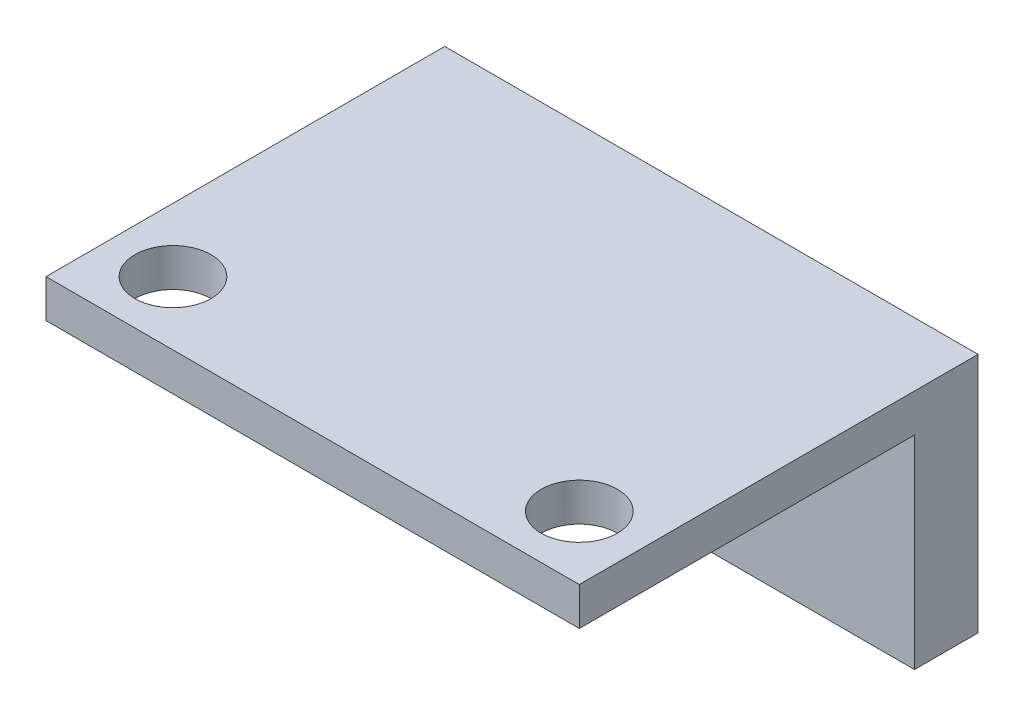
from build123d import *

# Parameters (mm, degrees)
SKETCH1_W           = 21
SKETCH1_H           = 15.7
BOSS_EXTRUDE1_DEPTH = 1.5
SKETCH2_R           = 1.5
CUT_EXTRUDE1_DEPTH  = 1.5
SKETCH3_W           = 21
SKETCH3_H           = 2.5
BOSS_EXTRUDE2_DEPTH = 8


with BuildPart() as part:
    # Sketch1 → Boss-Extrude1 (new body)
    with BuildSketch(Plane(origin=(0, 0, 0), x_dir=(1, 0, 0), z_dir=(0, 1, 0))):
        with Locations((10.5, 7.85)):
            Rectangle(SKETCH1_W, SKETCH1_H)
    extrude(amount=BOSS_EXTRUDE1_DEPTH)

    # Sketch2 → Cut-Extrude1 (cut)
    with BuildSketch(Plane(origin=(0, 1.5, 0), x_dir=(1, 0, 0), z_dir=(0, 1, 0))):
        with Locations(Location((2.5, 2.5, 0), (0, 0, 270))):
            Circle(SKETCH2_R)
        with Locations(Location((18.5, 2.5, 0), (0, 0, 270))):
            Circle(SKETCH2_R)
    extrude(amount=-CUT_EXTRUDE1_DEPTH, mode=Mode.SUBTRACT)

    # Sketch3 → Boss-Extrude2 (add)
    with BuildSketch(Plane.XZ):
        with Locations((10.5, -14.45)):
            Rectangle(SKETCH3_W, SKETCH3_H)
    extrude(amount=BOSS_EXTRUDE2_DEPTH)


solid = part.part
